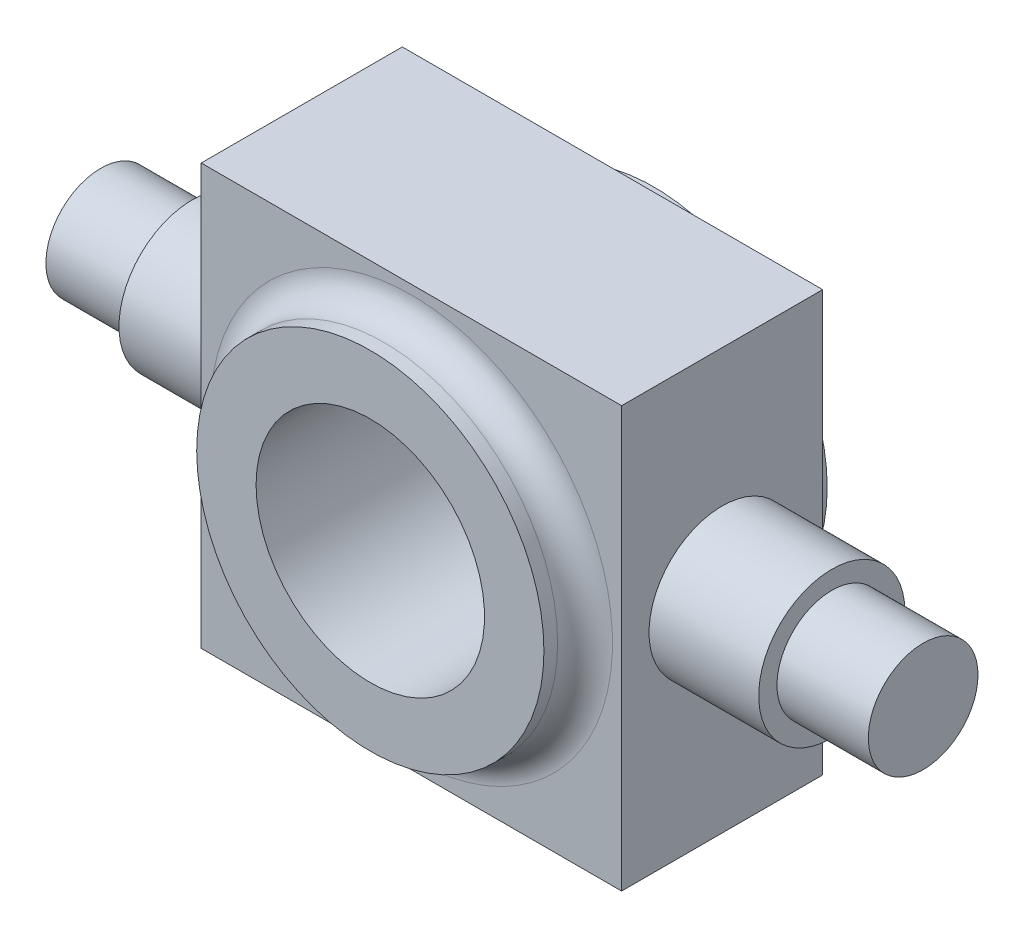
from build123d import *

# Parameters (mm, degrees)
SKETCH1_W                = 46
SKETCH1_H                = 22
BOSS_EXTRUDE1_DEPTH      = 23
BOSS_EXTRUDE2_DEPTH      = 4.5
BOSS_EXTRUDE2_DEPTH_BACK = 26.5
SKETCH2_R                = 19
FILLET1_R                = 3


with BuildPart() as part:
    # Sketch1 → Boss-Extrude1 (new, symmetric)
    with BuildSketch(Plane(origin=(0, 0, 0), x_dir=(1, 0, 0), z_dir=(0, 1, 0))):
        Rectangle(SKETCH1_W, SKETCH1_H)
    extrude(amount=BOSS_EXTRUDE1_DEPTH, both=True)

    # Sketch2 → Boss-Extrude2 (add, two sides: drawn at the far end of the back side and taken through both)
    with BuildSketch(Plane.XY.offset(11).offset(-BOSS_EXTRUDE2_DEPTH_BACK)):
        Circle(SKETCH2_R)
    extrude(amount=BOSS_EXTRUDE2_DEPTH + BOSS_EXTRUDE2_DEPTH_BACK)

    # Sketch3 → Cut-Revolve1 (revolve, cut)
    with BuildSketch(Plane(origin=(0, 0, 0), x_dir=(1, 0, 0), z_dir=(0, 1, 0)), mode=Mode.PRIVATE) as cut_revolve1_sk:
        Polygon((0, 15.5), (0, -15.5), (12.5, -15.5), (12.5, 12.5), (16, 12.5), (16, 15.5), align=None)
    revolve(cut_revolve1_sk.sketch.rotate(Axis((0, 0, -15.5), (0, 0, 1)), 180), axis=Axis((0, 0, -15.5), (0, 0, 1)), mode=Mode.SUBTRACT)

    # Sketch4 → Revolve1 (revolve)
    with BuildSketch(Plane(origin=(0, 0, 0), x_dir=(1, 0, 0), z_dir=(0, 1, 0))):
        Polygon((-45, 0), (-45, 6), (-35, 6), (-35, 8), (-23, 8), (-23, 0), align=None)
    revolve1 = revolve(axis=Axis((-23, 0, 0), (-1, 0, 0)))

    # Mirror1: Revolve1 across plane
    add(revolve1.mirror(Plane(origin=(0, 0, 0), x_dir=(0, 0, 1), z_dir=(1, 0, 0))))

    # Fillet1
    fillet1_edges = [part.edges().sort_by_distance(p)[0] for p in [
        (-19, 0, -11),
        (-19, 0, 11),
    ]]
    fillet(fillet1_edges, radius=FILLET1_R)


solid = part.part
